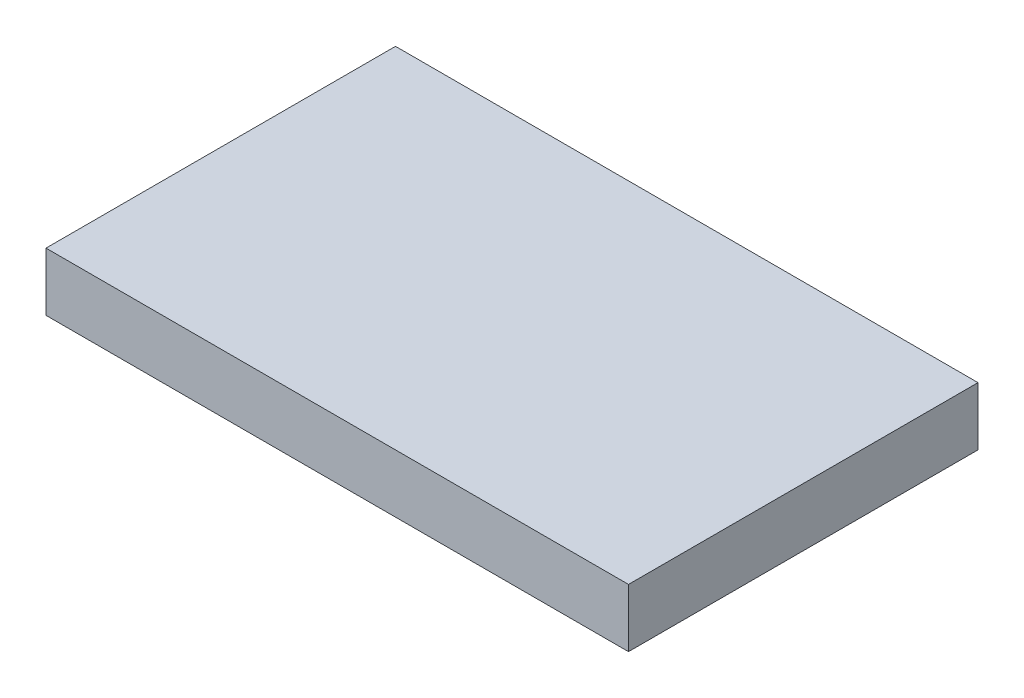
from build123d import *

# Parameters (mm, degrees)
SKETCH1_W           = 63.5
SKETCH1_H           = 38.1
BOSS_EXTRUDE1_DEPTH = 6.35


with BuildPart() as part:
    # Sketch1 → Boss-Extrude1 (new body)
    with BuildSketch(Plane(origin=(0, 0, 0), x_dir=(1, 0, 0), z_dir=(0, 1, 0))):
        with Locations((-2.442307692, 5.167408907)):
            Rectangle(SKETCH1_W, SKETCH1_H)
    extrude(amount=BOSS_EXTRUDE1_DEPTH)


solid = part.part
